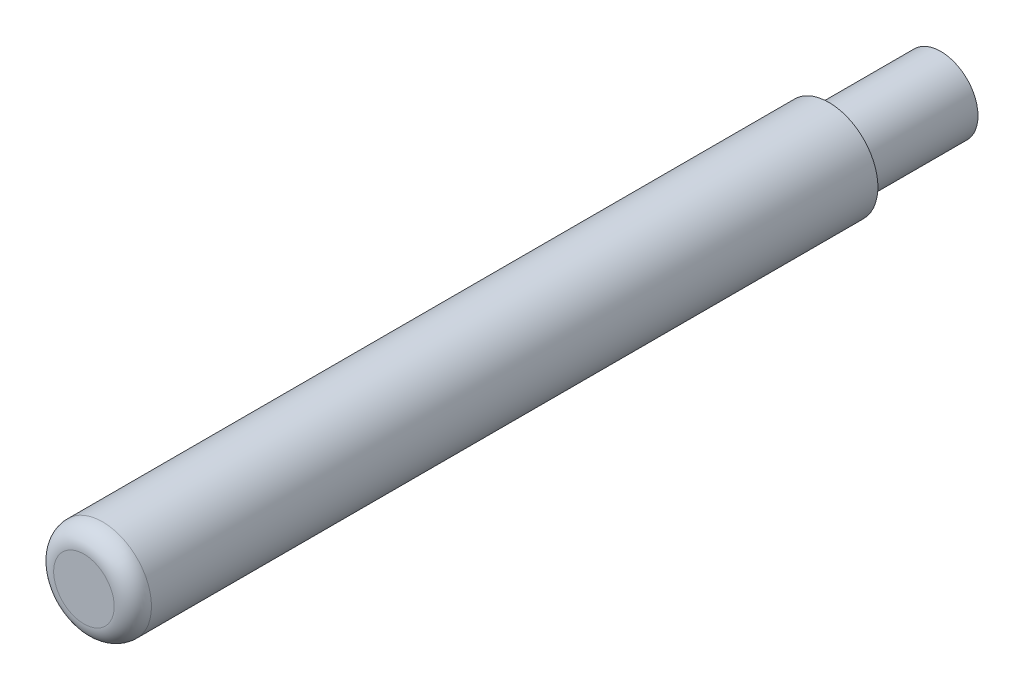
from build123d import *

# Parameters (mm, degrees)
SKETCH1_R           = 5.08
BOSS_EXTRUDE1_DEPTH = 15.24
SKETCH2_R           = 6.6675
BOSS_EXTRUDE2_DEPTH = 101.6
FILLET1_R           = 2.54


with BuildPart() as part:
    # Sketch1 → Boss-Extrude1 (new body)
    with BuildSketch(Plane.XY):
        Circle(SKETCH1_R)
    extrude(amount=-BOSS_EXTRUDE1_DEPTH)

    # Sketch2 → Boss-Extrude2 (add)
    with BuildSketch(Plane.XY):
        with Locations(Location((0, 0, 0), (0, 0, 180))):
            Circle(SKETCH2_R)
    extrude(amount=BOSS_EXTRUDE2_DEPTH)

    # Fillet1
    fillet1_edges = [part.edges().sort_by_distance(p)[0] for p in [
        (6.6675, 0, 101.6),
    ]]
    fillet(fillet1_edges, radius=FILLET1_R)


solid = part.part
